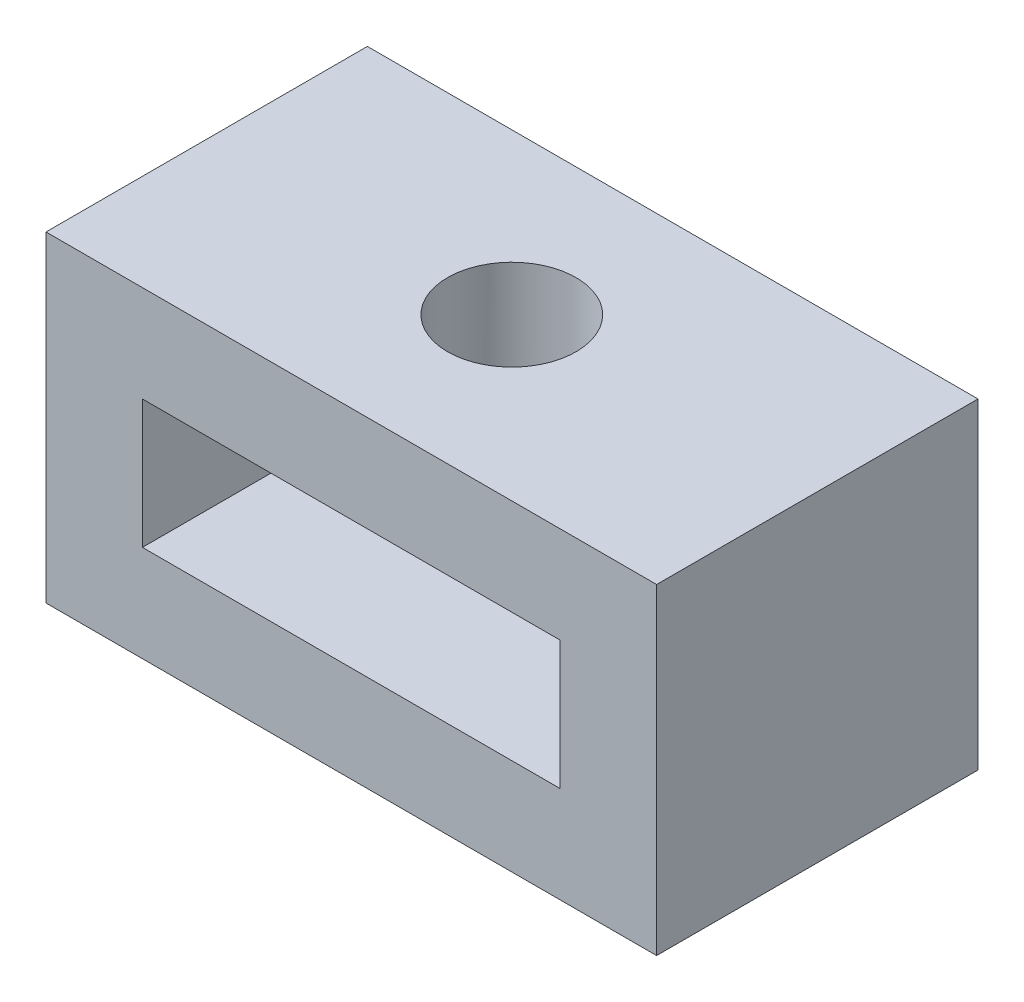
from build123d import *

# Parameters (mm, degrees)
SKETCH3_W           = 19
SKETCH3_H           = 10
SKETCH3_W_2         = 13
SKETCH3_H_2         = 4
BOSS_EXTRUDE1_DEPTH = 10
SKETCH4_R           = 2
CUT_EXTRUDE1_DEPTH  = 4


with BuildPart() as part:
    # Sketch3 → Boss-Extrude1 (new body)
    with BuildSketch(Plane.XY):
        with Locations((34.196690887, 38.585532183)):
            Rectangle(SKETCH3_W, SKETCH3_H)
        with Locations((34.196690887, 38.585532183)):
            Rectangle(SKETCH3_W_2, SKETCH3_H_2, mode=Mode.SUBTRACT)
    extrude(amount=BOSS_EXTRUDE1_DEPTH)

    # Sketch4 → Cut-Extrude1 (cut)
    with BuildSketch(Plane(origin=(0, 43.585532183, 0), x_dir=(1, 0, 0), z_dir=(0, 1, 0))):
        with Locations(Location((34.172706418, -4.982011648, 0), (0, 0, 270))):
            Circle(SKETCH4_R)
    extrude(amount=-CUT_EXTRUDE1_DEPTH, mode=Mode.SUBTRACT)


solid = part.part
